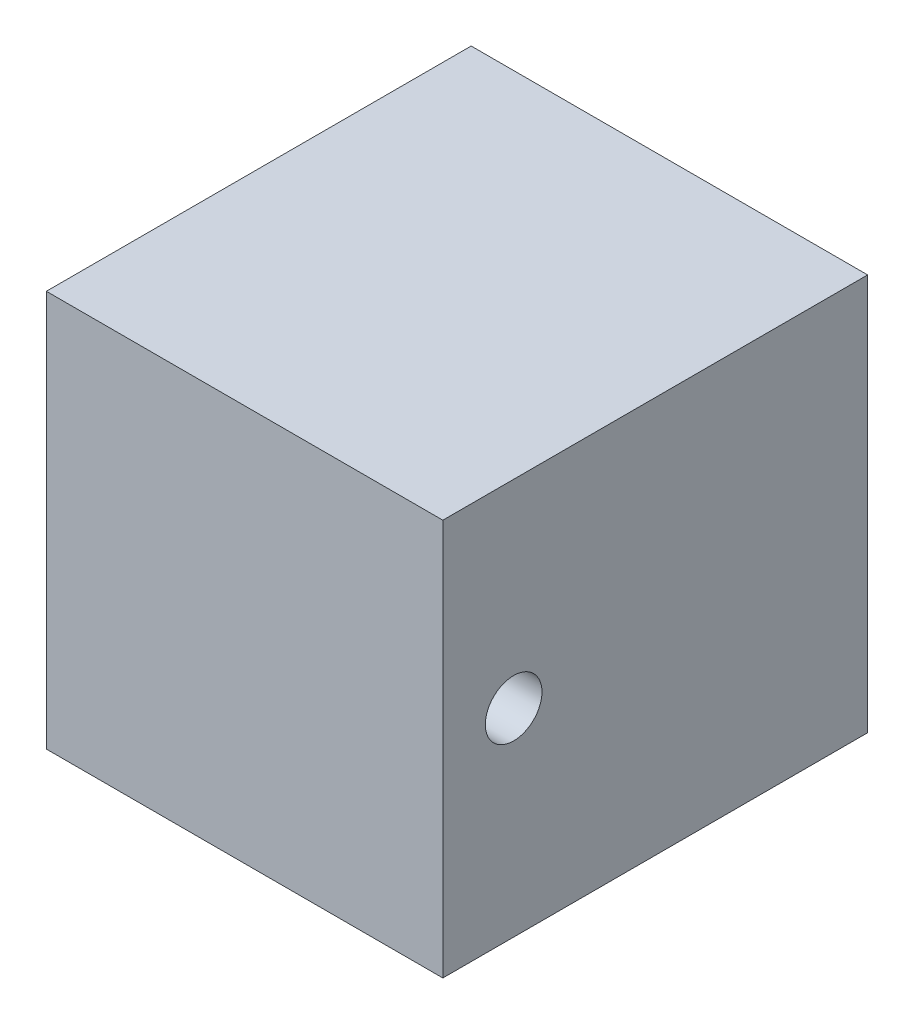
from build123d import *

# Parameters (mm, degrees)
SKETCH_1_W          = 14
SKETCH_1_H          = 14
SKETCH_1_W_2        = 12
SKETCH_1_H_2        = 12
EXTRUDE_1_DEPTH     = 10
SKETCH_2_W          = 14
SKETCH_2_H          = 14
EXTRUDE_2_DEPTH     = 5
SKETCH_3_R          = 1
CUT_EXTRUDE_1_DEPTH = 14


with BuildPart() as part:
    # 草图1 → 凸台-拉伸1 (new body)
    with BuildSketch(Plane.XY):
        with Locations((7, 7)):
            Rectangle(SKETCH_1_W, SKETCH_1_H)
        with Locations((7, 7)):
            Rectangle(SKETCH_1_W_2, SKETCH_1_H_2, mode=Mode.SUBTRACT)
    extrude(amount=EXTRUDE_1_DEPTH)

    # 草图2 → 凸台-拉伸2 (add)
    with BuildSketch(Plane.XY.offset(10)):
        with Locations((7, 7)):
            Rectangle(SKETCH_2_W, SKETCH_2_H)
    extrude(amount=EXTRUDE_2_DEPTH)

    # 草图3 → 切除-拉伸1 (cut)
    with BuildSketch(Plane(origin=(14, 0, 0), x_dir=(0, 0, -1), z_dir=(1, 0, 0))):
        with Locations((-12.5, 7)):
            Circle(SKETCH_3_R)
    extrude(amount=-CUT_EXTRUDE_1_DEPTH, mode=Mode.SUBTRACT)


solid = part.part
